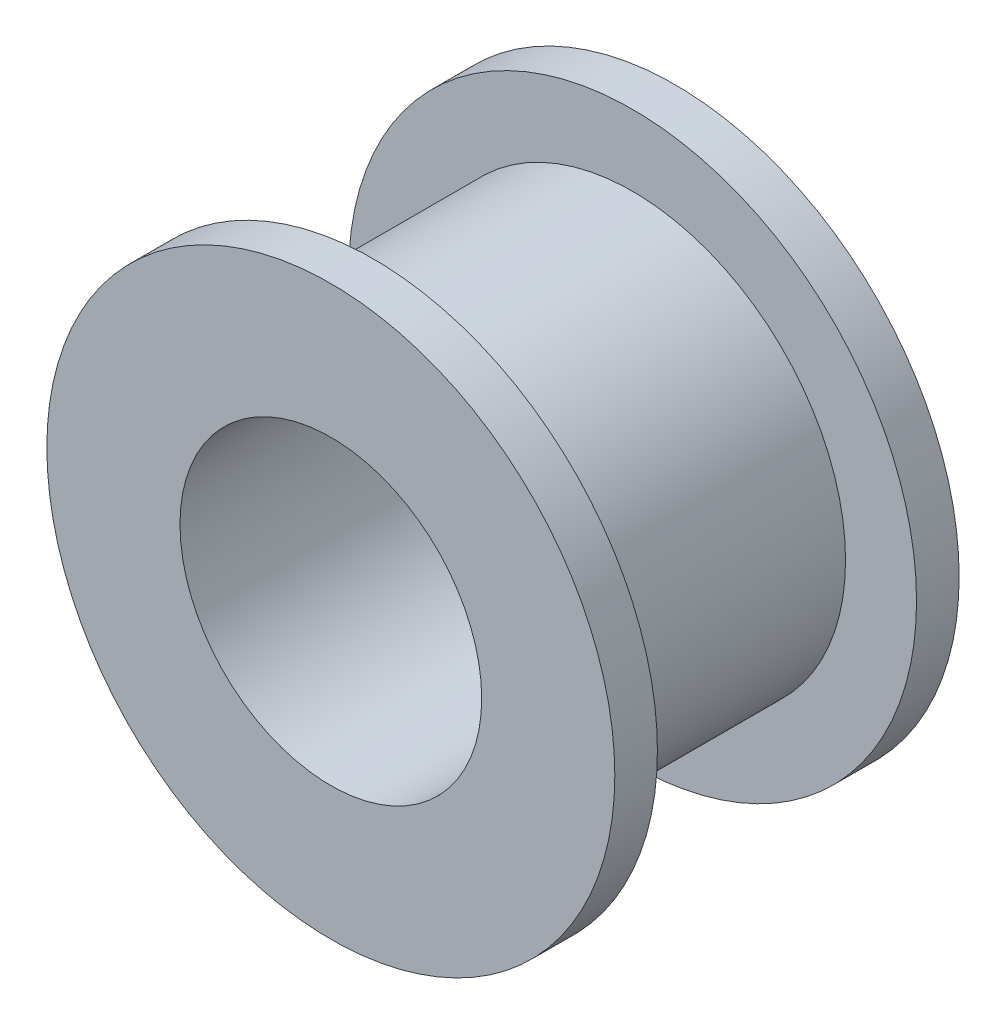
from build123d import *

# Parameters (mm, degrees)
SKETCH2_R               = 8
SKETCH2_R_2             = 4.25
BOSS_EXTRUDE1_DEPTH     = 16
SKETCH3_OUTSIDE_W       = 23.542
SKETCH3_OUTSIDE_H       = 23.542
SKETCH3_OUTSIDE_R       = 6
CUT_EXTRUDE1_DEPTH      = 7.3
CUT_EXTRUDE2_REACH      = 26
CUT_EXTRUDE2_END_RADIUS = 4.25
SKETCH6_R               = 1.75
CUT_EXTRUDE3_REACH      = 26
CUT_EXTRUDE3_END_RADIUS = 4.25
SKETCH5_R               = 1.75
CUT_EXTRUDE4_START      = -5.75
SKETCH7_R               = 8
CUT_EXTRUDE4_DEPTH      = 5.75
CUT_EXTRUDE5_START      = -0.55
SKETCH9_R               = 8
CUT_EXTRUDE5_DEPTH      = 0.55
SKETCH10_R              = 1
CUT_EXTRUDE6_DEPTH      = 1


with BuildPart() as part:
    # Sketch2 → Boss-Extrude1 (new body)
    with BuildSketch(Plane.XY):
        Circle(SKETCH2_R)
        Circle(SKETCH2_R_2, mode=Mode.SUBTRACT)
    extrude(amount=BOSS_EXTRUDE1_DEPTH)

    # Sketch3 outside → Cut-Extrude1 (cut)
    with BuildSketch(Plane.XY.offset(1.2)):
        Rectangle(SKETCH3_OUTSIDE_W, SKETCH3_OUTSIDE_H)
        with Locations(Location((0, 0, 0), (0, 0, 180))):
            Circle(SKETCH3_OUTSIDE_R, mode=Mode.SUBTRACT)
    extrude(amount=CUT_EXTRUDE1_DEPTH, mode=Mode.SUBTRACT)

    # Cut-Extrude2: up to this cylinder (the profile starts outside it)
    cut_extrude2_end = Plane(origin=(0, 0, 12.25), z_dir=(0, 0, -1)) * Cylinder(CUT_EXTRUDE2_END_RADIUS, 61.5, mode=Mode.PRIVATE)
    # Sketch6 → Cut-Extrude2 (cut, up to the surface)
    with BuildSketch(Plane(origin=(8, 0, 0), x_dir=(0, 0, -1), z_dir=(1, 0, 0)), mode=Mode.PRIVATE) as cut_extrude2_sk1:
        with Locations((-12.25, 0)):
            Circle(SKETCH6_R)
    cut_extrude2_tool1 = extrude(cut_extrude2_sk1.sketch, amount=-CUT_EXTRUDE2_REACH, mode=Mode.PRIVATE) - cut_extrude2_end
    add(cut_extrude2_tool1.solids().sort_by_distance((8, 0, 12.25))[0], mode=Mode.SUBTRACT)

    # Cut-Extrude3: up to this cylinder (the profile starts outside it)
    cut_extrude3_end = Plane(origin=(0, 0, 12.25), z_dir=(0, 0, -1)) * Cylinder(CUT_EXTRUDE3_END_RADIUS, 61.5, mode=Mode.PRIVATE)
    # Sketch5 → Cut-Extrude3 (cut, up to the surface)
    with BuildSketch(Plane(origin=(0, 8, 0), x_dir=(1, 0, 0), z_dir=(0, 1, 0)), mode=Mode.PRIVATE) as cut_extrude3_sk1:
        with Locations(Location((0, -12.25, 0), (0, 0, 270))):
            Circle(SKETCH5_R)
    cut_extrude3_tool1 = extrude(cut_extrude3_sk1.sketch, amount=-CUT_EXTRUDE3_REACH, mode=Mode.PRIVATE) - cut_extrude3_end
    add(cut_extrude3_tool1.solids().sort_by_distance((0, 8, 12.25))[0], mode=Mode.SUBTRACT)

    # Sketch7 → Cut-Extrude4 (cut)
    with BuildSketch(Plane.XY.offset(16).offset(CUT_EXTRUDE4_START)):
        Circle(SKETCH7_R)
    extrude(amount=CUT_EXTRUDE4_DEPTH, mode=Mode.SUBTRACT)

    # Sketch9 → Cut-Extrude5 (cut)
    with BuildSketch(Plane.XY.offset(10.25).offset(CUT_EXTRUDE5_START)):
        Circle(SKETCH9_R)
    extrude(amount=CUT_EXTRUDE5_DEPTH, mode=Mode.SUBTRACT)

    # Sketch10 → Cut-Extrude6 (cut)
    with BuildSketch(Plane(origin=(0, 0, 0), x_dir=(-1, 0, 0), z_dir=(0, 0, -1))):
        with Locations((0, 6.125)):
            Circle(SKETCH10_R)
        with Locations((5.825221162, 1.892729091)):
            Circle(SKETCH10_R)
        with Locations((3.60018467, -4.955229091)):
            Circle(SKETCH10_R)
        with Locations((-3.60018467, -4.955229091)):
            Circle(SKETCH10_R)
        with Locations((-5.825221162, 1.892729091)):
            Circle(SKETCH10_R)
    extrude(amount=-CUT_EXTRUDE6_DEPTH, mode=Mode.SUBTRACT)


solid = part.part
